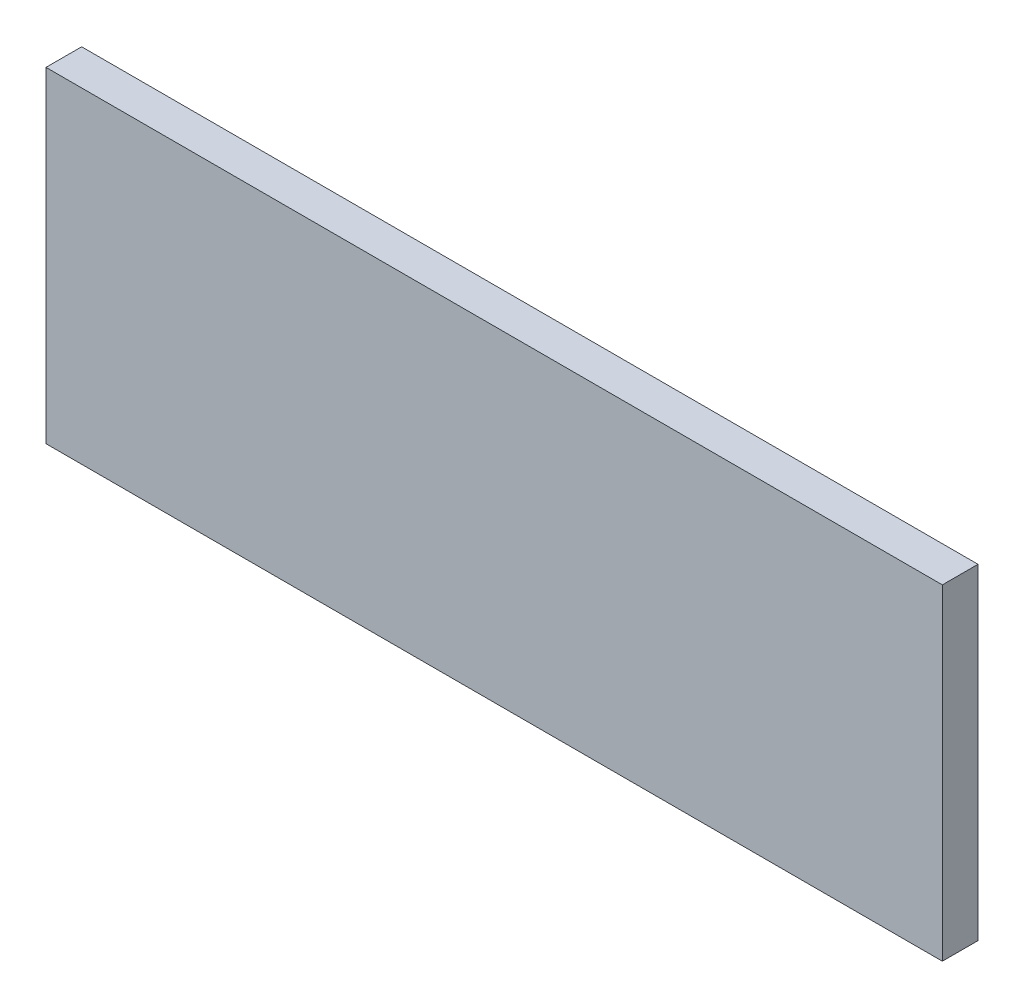
from build123d import *

# Parameters (mm, degrees)
SKETCH2_W           = 139.7
SKETCH2_H           = 50.8
BOSS_EXTRUDE1_DEPTH = 5.55625


with BuildPart() as part:
    # Sketch2 → Boss-Extrude1 (new body)
    with BuildSketch(Plane.XY):
        Rectangle(SKETCH2_W, SKETCH2_H)
    extrude(amount=BOSS_EXTRUDE1_DEPTH)


solid = part.part
